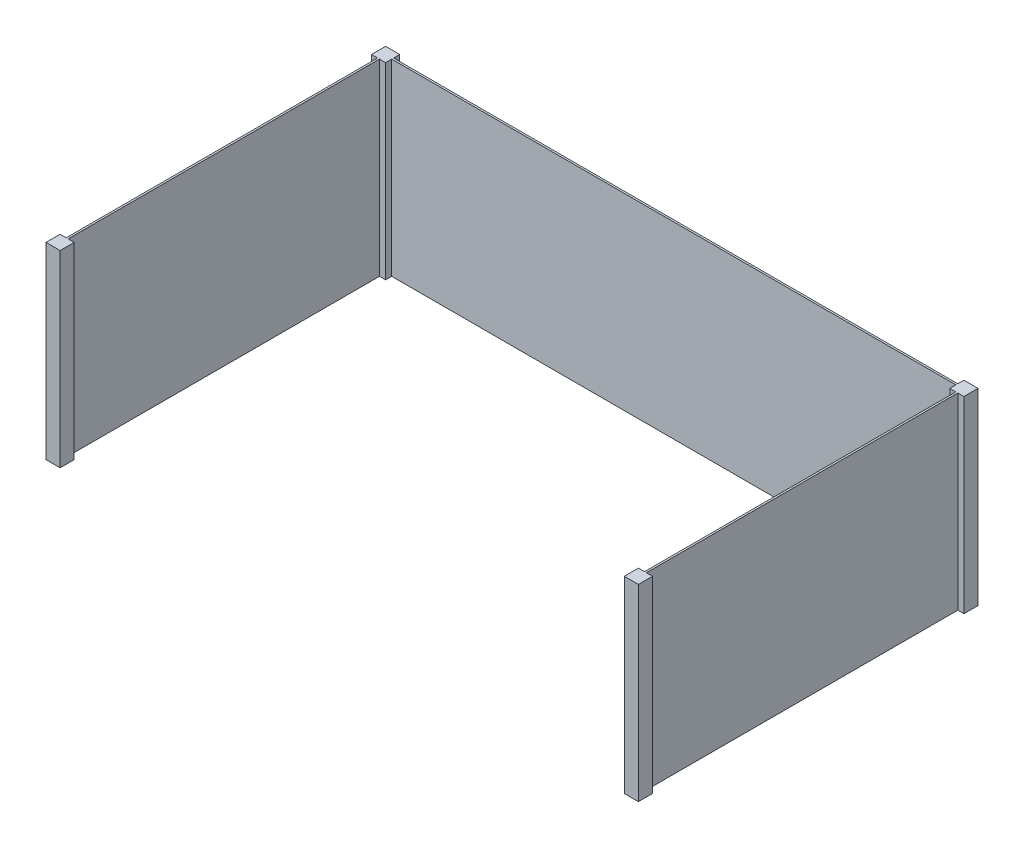
from build123d import *

# Parameters (mm, degrees)
BOSS_EXTRUDE1_DEPTH = 1000


with BuildPart() as part:
    # Sketch1 → Boss-Extrude1 (new body)
    with BuildSketch(Plane(origin=(0, 0, 0), x_dir=(1, 0, 0), z_dir=(0, 1, 0))):
        Polygon((-37.5, 37.5), (37.5, 37.5), (37.5, 5), (3035.9725355, 5), (3035.9725355, 37.5), (3110.9725355, 37.5), (3110.9725355, -37.5), (3078.4725355, -37.5), (3078.4725355, -1692.393993557), (3110.9725355, -1692.393993557), (3110.9725355, -1767.393993557), (3035.9725355, -1767.393993557), (3035.9725355, -1692.393993557), (3068.4725355, -1692.393993557), (3068.4725355, -37.5), (3035.9725355, -37.5), (3035.9725355, -5), (37.5, -5), (37.5, -37.5), (5, -37.5), (5, -1692.393993557), (37.5, -1692.393993557), (37.5, -1767.393993557), (-37.5, -1767.393993557), (-37.5, -1692.393993557), (-5, -1692.393993557), (-5, -37.5), (-37.5, -37.5), align=None)
    extrude(amount=BOSS_EXTRUDE1_DEPTH)


solid = part.part
